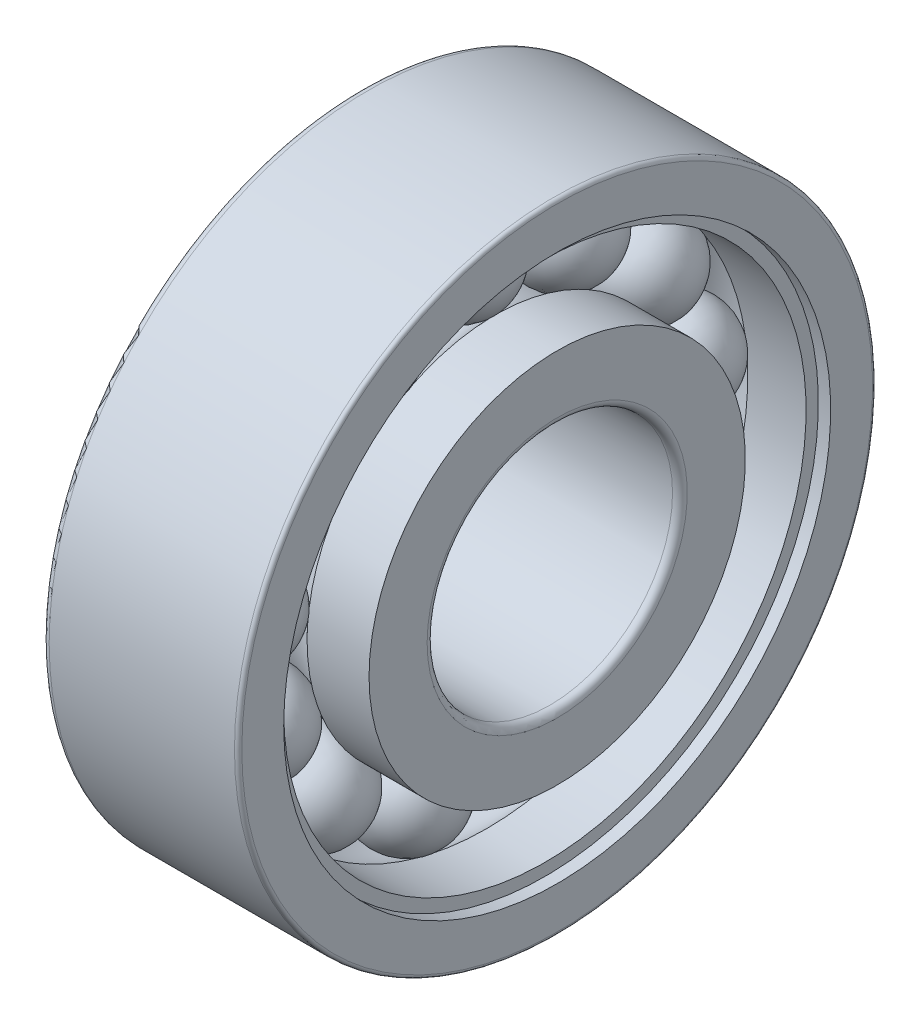
from build123d import *

# Parameters (mm, degrees)
CIRCULAR_PATTERN1_COUNT = 13
FILLET1_R               = 0.3
FILLET2_R               = 0.15


with BuildPart() as part:
    # Sketch1 → Revolve1 (revolve)
    with BuildSketch(Plane.XY):
        with BuildLine():
            Line((-2, 9), (2, 9))
            ThreePointArc((2, 9), (0, 7), (-2, 9))
        make_face()
    revolve1 = revolve(axis=Axis((-3.091912561, 9, 0), (1, 0, 0)))

    # Sketch2 → Revolve2 (revolve)
    with BuildSketch(Plane.XY, mode=Mode.PRIVATE) as revolve2_sk:
        with BuildLine():
            Line((-4, 7.666666667), (-1.4772685, 7.666666667))
            ThreePointArc((-1.4772685, 7.666666667), (0, 7.01), (1.4772685, 7.666666667))
            Line((1.4772685, 7.666666667), (4, 7.666666667))
            Line((4, 7.666666667), (4, 5))
            Line((4, 5), (-4, 5))
            Line((-4, 5), (-4, 7.666666667))
        make_face()
    revolve(revolve2_sk.sketch.rotate(Axis((-2.992358943, 0, 0), (1, 0, 0)), 90), axis=Axis((-2.992358943, 0, 0), (1, 0, 0)))

    # Sketch3 → Revolve3 (revolve)
    with BuildSketch(Plane.XY, mode=Mode.PRIVATE) as revolve3_sk:
        with BuildLine():
            Line((-4, 10.333333333), (-4, 13))
            Line((-4, 13), (4, 13))
            Line((4, 13), (4, 11.143333333))
            Line((4, 11.143333333), (3.5, 11.143333333))
            Line((3.5, 11.143333333), (3.5, 10.643333333))
            Line((3.5, 10.643333333), (1.122299227, 10.643333333))
            ThreePointArc((1.122299227, 10.643333333), (-0.235639123, 10.975999545), (-1.4772685, 10.333333333))
            Line((-1.4772685, 10.333333333), (-4, 10.333333333))
        make_face()
    revolve(revolve3_sk.sketch.rotate(Axis((-2.992358943, 0, 0), (1, 0, 0)), 90), axis=Axis((-2.992358943, 0, 0), (1, 0, 0)))

    # Circular-Pattern1: Revolve1 ×13 about axis
    circular_pattern1_axis = Axis((0, 0, 0), (1, 0, 0))
    for i in range(1, CIRCULAR_PATTERN1_COUNT):
        add(revolve1.rotate(circular_pattern1_axis, i * 360 / CIRCULAR_PATTERN1_COUNT))

    # Fillet1
    fillet1_edges = [part.edges().sort_by_distance(p)[0] for p in [
        (-4, 0, -13),
        (4, 0, -5),
    ]]
    fillet(fillet1_edges, radius=FILLET1_R)

    # Fillet2
    fillet2_edges = [part.edges().sort_by_distance(p)[0] for p in [
        (4, 0, -13),
        (-4, 0, -5),
    ]]
    fillet(fillet2_edges, radius=FILLET2_R)


solid = part.part
